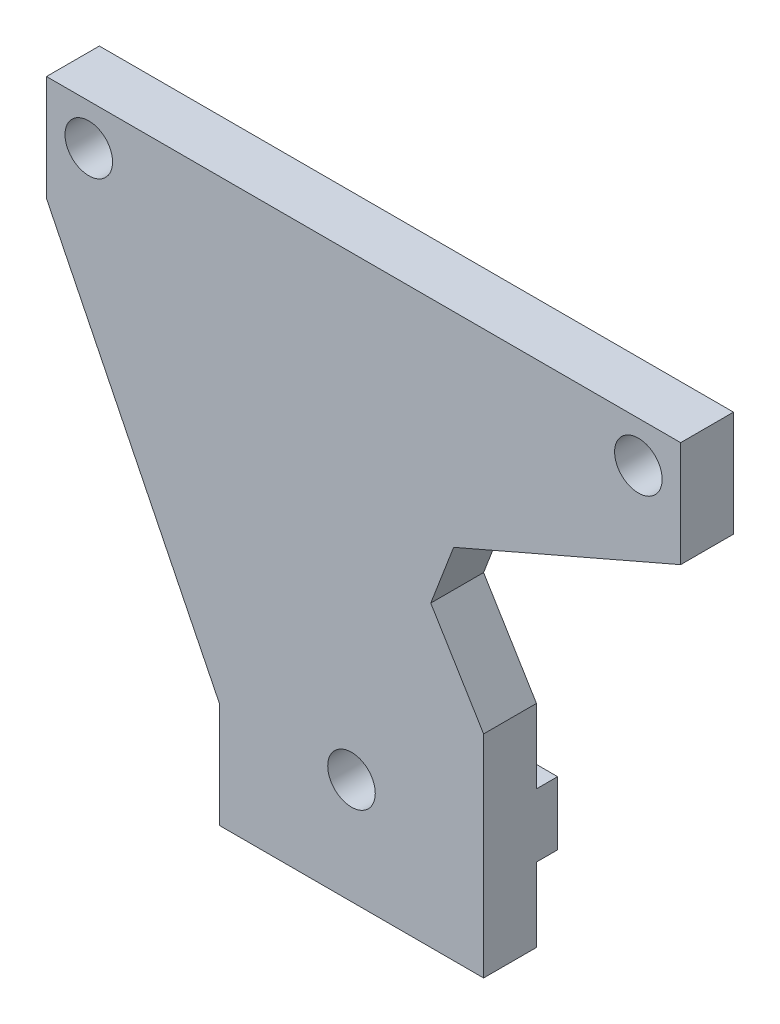
from build123d import *

# Parameters (mm, degrees)
BOSS_EXTRU_1_DEPTH      = 5
ESQUISSE2_W             = 25
ESQUISSE2_H             = 6
BOSS_EXTRU_2_DEPTH      = 2
ESQUISSE3_R             = 2.25
ENL_V_MAT_EXTRU_3_DEPTH = 8.1


with BuildPart() as part:
    # Esquisse1 → Boss.-Extru.1 (new body)
    with BuildSketch(Plane.XY):
        Polygon((0, 0), (60, 0), (60, -10), (38.522739923, -19.314739888), (36.355716988, -24.967843196), (41.356924968, -33.188115427), (41.356924968, -53.188115427), (16.356924968, -53.188115427), (16.356924968, -43.188115427), (0, -10), align=None)
    extrude(amount=BOSS_EXTRU_1_DEPTH)

    # Esquisse2 → Boss.-Extru.2 (add)
    with BuildSketch(Plane(origin=(0, 0, 0), x_dir=(-1, 0, 0), z_dir=(0, 0, -1))):
        with Locations((-28.856924968, -43.188115427)):
            Rectangle(ESQUISSE2_W, ESQUISSE2_H)
    extrude(amount=BOSS_EXTRU_2_DEPTH)

    # Esquisse3 → Enlèv. mat.-Extru.3 (cut)
    with BuildSketch(Plane(origin=(0, 0, -2), x_dir=(-1, 0, 0), z_dir=(0, 0, -1))):
        with Locations((-28.856924968, -43.188115427)):
            Circle(ESQUISSE3_R)
        with Locations(Location((-56, -3.88, 0), (0, 0, 180))):
            Circle(ESQUISSE3_R)
        with Locations(Location((-4, -3.88, 0), (0, 0, 180))):
            Circle(ESQUISSE3_R)
    extrude(amount=-ENL_V_MAT_EXTRU_3_DEPTH, mode=Mode.SUBTRACT)


solid = part.part
